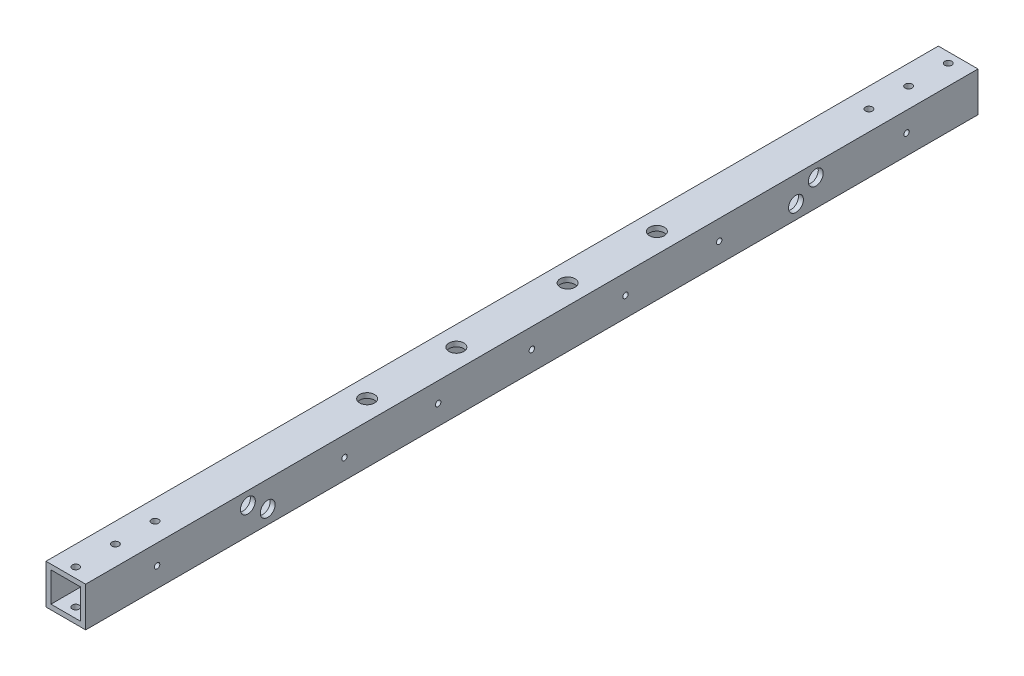
from build123d import *

# Parameters (mm, degrees)
SKETCH1_W                    = 25.4
SKETCH1_H                    = 25.4
SKETCH1_W_2                  = 19.05
SKETCH1_H_2                  = 19.05
EXTRUDE_THIN1_DEPTH          = 571.5
F_8_CLEARANCE_HOLE1_D        = 4.4958
F_8_32_TAPPED_HOLE1_D        = 3.4544
F_8_32_TAPPED_HOLE1_DEPTH    = 12.2936
F_8_32_TAPPED_HOLE1_TIP      = 1.037806461
F_3_8_0_375_DIAMETER_HOLE2_D = 9.525
F_3_8_0_375_DIAMETER_HOLE3_D = 9.525


with BuildPart() as part:
    # Sketch1 → Extrude-Thin1 (new body)
    with BuildSketch(Plane.XY):
        Rectangle(SKETCH1_W, SKETCH1_H)
        Rectangle(SKETCH1_W_2, SKETCH1_H_2, mode=Mode.SUBTRACT)
    extrude(amount=EXTRUDE_THIN1_DEPTH)

    # #8 Clearance Hole1 (through all)
    with Locations(Plane(origin=(0, 12.7, 565.15), x_dir=(0, 0, 1), z_dir=(0, 1, 0))):
        with Locations((0, 0), (-558.8, 0), (-533.4, 0), (-508, 0), (-25.4, 0), (-50.8, 0)):
            Hole(F_8_CLEARANCE_HOLE1_D / 2)

    # #8-32 Tapped Hole1
    with Locations(Plane(origin=(12.7, -82.55, 285.75), x_dir=(0, 0, -1), z_dir=(1, 0, 0))):
        with Locations((-240, 82.55), (-120, 82.55), (-60, 82.55), (0, 82.55), (60, 82.55), (120, 82.55), (240, 82.55)):
            Hole(F_8_32_TAPPED_HOLE1_D / 2, depth=F_8_32_TAPPED_HOLE1_DEPTH)
            with Locations((0, 0, -(F_8_32_TAPPED_HOLE1_DEPTH + F_8_32_TAPPED_HOLE1_TIP / 2))):  # 118° drill point
                Cone(0, F_8_32_TAPPED_HOLE1_D / 2, F_8_32_TAPPED_HOLE1_TIP, mode=Mode.SUBTRACT)

    # 3/8 (0.375) Diameter Hole2 (through all)
    with Locations(Plane(origin=(-12.7, -82.55, 285.75), x_dir=(0, 0, -1), z_dir=(-1, 0, 0))):
        with Locations((-181.864, -86.995), (-169.164, -78.74), (169.164, -78.74), (181.864, -86.995), (181.864, -57.15), (-181.864, -57.15)):
            Hole(F_3_8_0_375_DIAMETER_HOLE2_D / 2)

    # 3/8 (0.375) Diameter Hole3 (through all)
    with Locations(Plane(origin=(-346.075, 12.7, 285.75), x_dir=(0, 0, 1), z_dir=(0, 1, 0))):
        with Locations((-92.7735, 346.075), (-35.6235, 346.075), (35.6235, 346.075), (92.7735, 346.075), (-19.05, -346.775), (53.975, -346.775), (127, -346.775), (-381, -114.3), (-381, -130.175), (-381, -146.05), (-381, 114.3), (-381, 98.425), (-381, 82.55)):
            Hole(F_3_8_0_375_DIAMETER_HOLE3_D / 2)


solid = part.part
